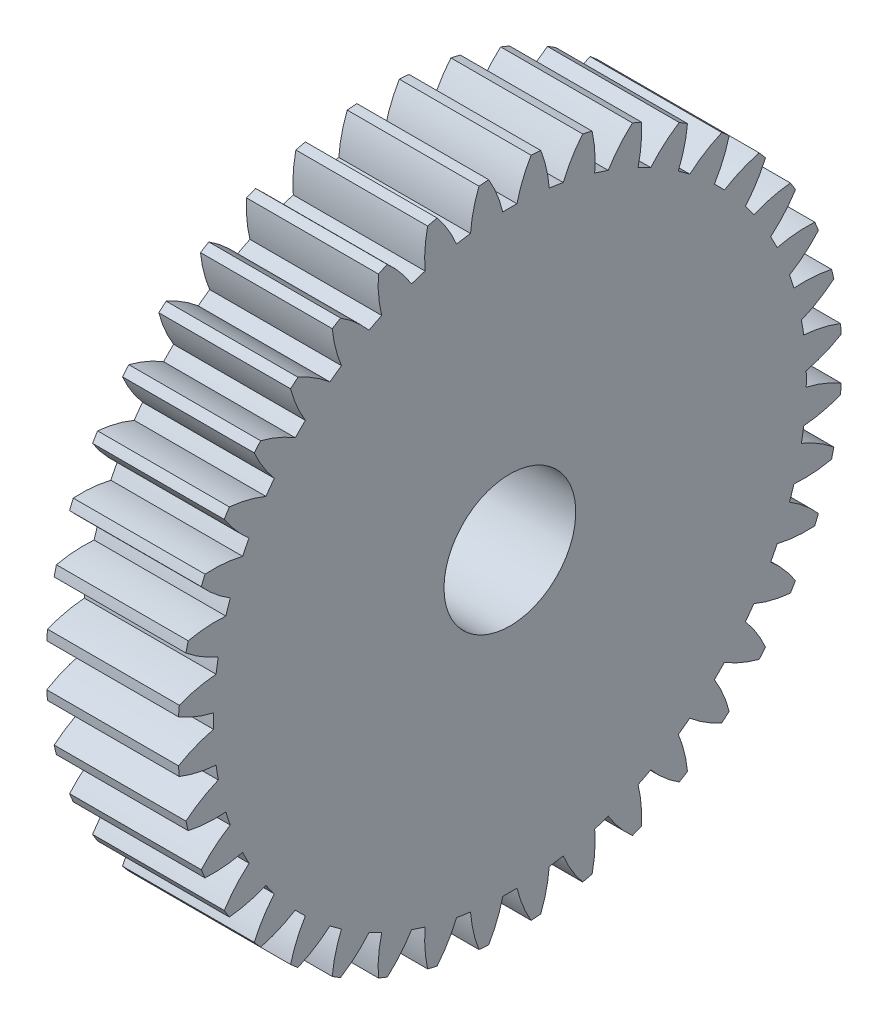
from build123d import *

# Parameters (mm, degrees)
BASPROSKE_W        = 5
BASPROSKE_H        = 12.6
TOOTHCUT_DEPTH     = 19.507295859
TEETHCUTS_COUNT    = 40
TEETHCUTS_ANGLE    = 351
BORSKE_R           = 0.4
BORE_DEPTH         = 50.0000508
SKETCH1_R          = 2.5
CUT_EXTRUDE1_DEPTH = 19.472291037


with BuildPart() as part:
    # BasProSke → Base-Revolve (revolve)
    with BuildSketch(Plane(origin=(0, 0, 0), x_dir=(1, 0, 0), z_dir=(0, 1, 0)), mode=Mode.PRIVATE) as base_revolve_sk:
        with Locations((2.5, 6.3)):
            Rectangle(BASPROSKE_W, BASPROSKE_H)
    revolve(base_revolve_sk.sketch.rotate(Axis((-10, 0, 0), (1, 0, 0)), 180), axis=Axis((-10, 0, 0), (1, 0, 0)))

    # TooCutSke → ToothCut (cut, through all)
    with BuildSketch(Plane(origin=(0, 0, 0), x_dir=(0, 0, -1), z_dir=(1, 0, 0))):
        with BuildLine():
            ThreePointArc((0.269437699, 11.245772731), (0, 11.249), (-0.269437699, 11.245772731))
            ThreePointArc((-0.269437699, 11.245772731), (-0.49248792, 11.943313622), (-0.81905568, 12.598804426))
            ThreePointArc((-0.81905568, 12.598804426), (0, 12.6254), (0.81905568, 12.598804426))
            ThreePointArc((0.81905568, 12.598804426), (0.49248792, 11.943313622), (0.269437699, 11.245772731))
        make_face()
    toothcut = extrude(amount=TOOTHCUT_DEPTH, mode=Mode.SUBTRACT)

    # TeethCuts: ToothCut ×40 about axis
    teethcuts_axis = Axis((-10, 0, 0), (1, 0, 0))
    for i in range(1, TEETHCUTS_COUNT):
        add(toothcut.rotate(teethcuts_axis, i * TEETHCUTS_ANGLE / (TEETHCUTS_COUNT - 1)), mode=Mode.SUBTRACT)

    # BorSke → Bore (cut, symmetric)
    with BuildSketch(Plane(origin=(0, 0, 0), x_dir=(0, 0, -1), z_dir=(1, 0, 0))):
        with Locations(Location((0, 0, 0), (0, 0, 180))):
            Circle(BORSKE_R)
    extrude(amount=BORE_DEPTH, both=True, mode=Mode.SUBTRACT)

    # Sketch1 → Cut-Extrude1 (cut, through all)
    with BuildSketch(Plane.ZY):
        Circle(SKETCH1_R)
    extrude(amount=-CUT_EXTRUDE1_DEPTH, mode=Mode.SUBTRACT)


solid = part.part
